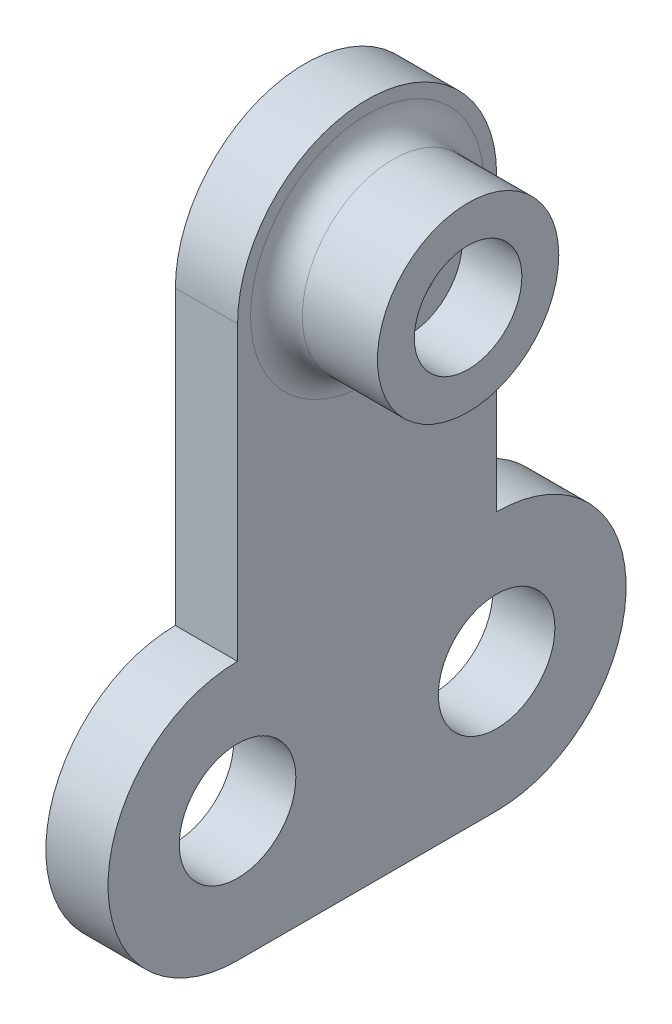
from build123d import *

# Parameters (mm, degrees)
SKETCH_1_R      = 2.25
SKETCH_1_R_2    = 2.075
EXTRUDE_1_DEPTH = 2.4
SKETCH_4_R      = 3.5
SKETCH_4_R_2    = 2.075
EXTRUDE_2_DEPTH = 3.9
FILLET_1_R      = 1
SKETCH_5_R      = 2.075
SKETCH_5_R_2    = 1.2
EXTRUDE_3_DEPTH = 4


with BuildPart() as part:
    # 草图1 → 凸台-拉伸1 (new body)
    with BuildSketch(Plane(origin=(0, 0, 0), x_dir=(0, 0, -1), z_dir=(1, 0, 0))):
        with BuildLine():
            Line((-5, 0), (5, 0))
            ThreePointArc((5, 0), (10, 5), (5, 10))
            Line((5, 10), (5, 21.282156306))
            ThreePointArc((5, 21.282156306), (0, 26.282156306), (-5, 21.282156306))
            Line((-5, 21.282156306), (-5, 10))
            ThreePointArc((-5, 10), (-10, 5), (-5, 0))
        make_face()
        with Locations((-5, 5)):
            Circle(SKETCH_1_R, mode=Mode.SUBTRACT)
        with Locations((5, 5)):
            Circle(SKETCH_1_R, mode=Mode.SUBTRACT)
        with Locations((0, 21.282156306)):
            Circle(SKETCH_1_R_2, mode=Mode.SUBTRACT)
    extrude(amount=EXTRUDE_1_DEPTH)

    # 草图4 → 凸台-拉伸2 (add)
    with BuildSketch(Plane(origin=(2.4, 0, 0), x_dir=(0, 0, -1), z_dir=(1, 0, 0))):
        with Locations((0, 21.282156306)):
            Circle(SKETCH_4_R)
        with Locations((0, 21.282156306)):
            Circle(SKETCH_4_R_2, mode=Mode.SUBTRACT)
    extrude(amount=EXTRUDE_2_DEPTH)

    # 圆角1
    fillet_1_edges = [part.edges().sort_by_distance(p)[0] for p in [
        (2.4, 21.282156306, 3.5),
    ]]
    fillet(fillet_1_edges, radius=FILLET_1_R)

    # 草图5 → 凸台-拉伸3 (add)
    with BuildSketch(Plane.ZY):
        with Locations((0, 21.282156306)):
            Circle(SKETCH_5_R)
        with Locations((0, 21.282156306)):
            Circle(SKETCH_5_R_2, mode=Mode.SUBTRACT)
    extrude(amount=-EXTRUDE_3_DEPTH)


solid = part.part
